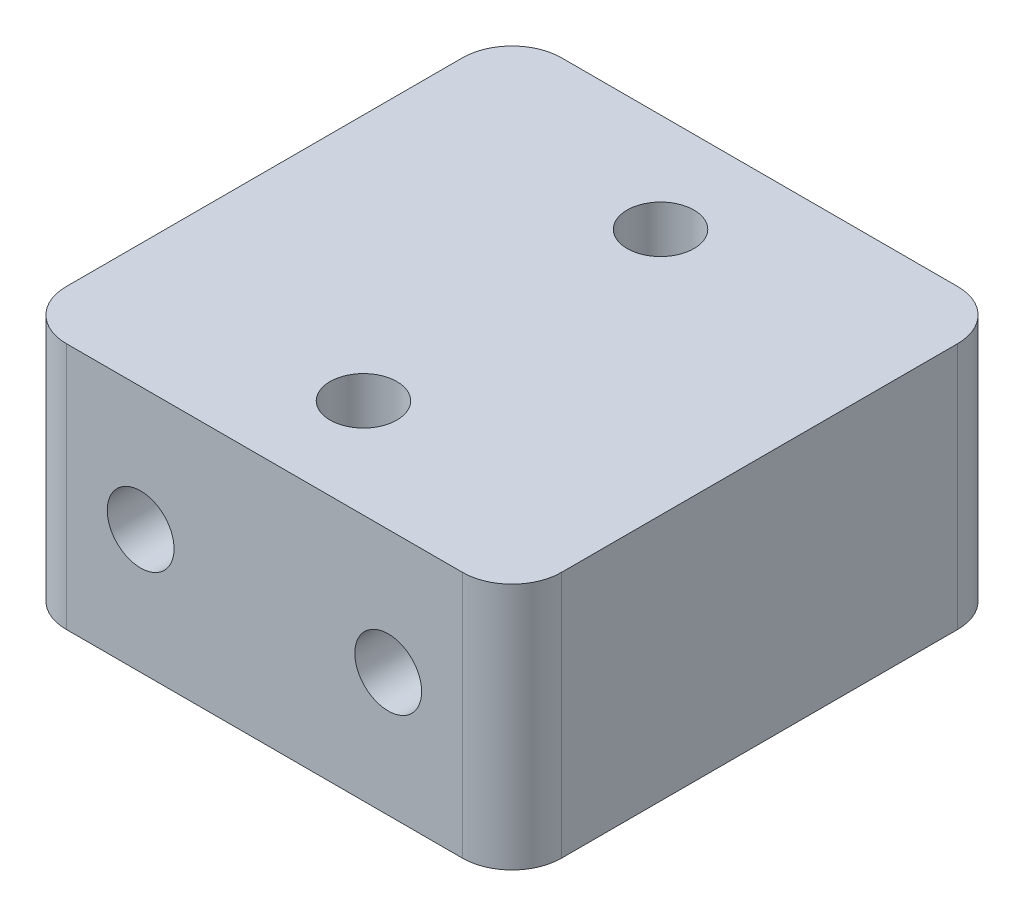
from build123d import *

# Parameters (mm, degrees)
SKETCH_1_W          = 20
SKETCH_1_H          = 20
SKETCH_1_R          = 1.35
EXTRUDE_1_DEPTH     = 10
SKETCH_3_R          = 1.35
CUT_EXTRUDE_1_DEPTH = 25.494897428
FILLET_1_R          = 2


with BuildPart() as part:
    # 草图1 → 凸台-拉伸1 (new body)
    with BuildSketch(Plane(origin=(0, 0, 0), x_dir=(1, 0, 0), z_dir=(0, 1, 0))):
        Rectangle(SKETCH_1_W, SKETCH_1_H)
        with Locations(Location((0, 6, 0), (0, 0, 270))):
            Circle(SKETCH_1_R, mode=Mode.SUBTRACT)
        with Locations(Location((0, -6, 0), (0, 0, 90))):
            Circle(SKETCH_1_R, mode=Mode.SUBTRACT)
    extrude(amount=EXTRUDE_1_DEPTH)

    # 草图3 → 切除-拉伸1 (cut, through all)
    with BuildSketch(Plane(origin=(0, 0, -10), x_dir=(-1, 0, 0), z_dir=(0, 0, -1))):
        with Locations((5, 5)):
            Circle(SKETCH_3_R)
        with Locations(Location((-5, 5, 0), (0, 0, 180))):
            Circle(SKETCH_3_R)
    extrude(amount=-CUT_EXTRUDE_1_DEPTH, mode=Mode.SUBTRACT)

    # 圆角1
    fillet_1_edges = [part.edges().sort_by_distance(p)[0] for p in [
        (10, 5, 10),
        (-10, 5, 10),
        (-10, 5, -10),
        (10, 5, -10),
    ]]
    fillet(fillet_1_edges, radius=FILLET_1_R)


solid = part.part
